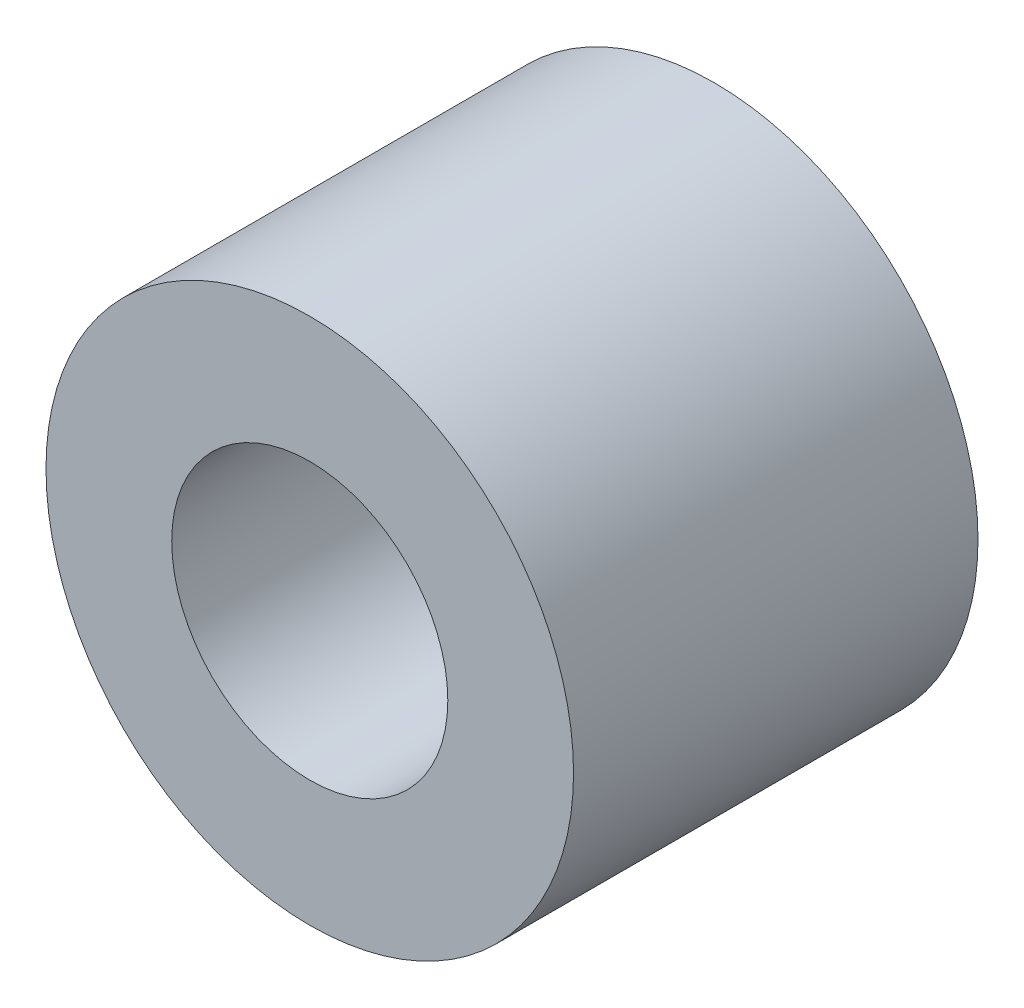
from build123d import *

# Parameters (mm, degrees)
CROQUIS1_R              = 15
SALIENTE_EXTRUIR1_DEPTH = 23
CROQUIS2_R              = 7.85
CORTAR_EXTRUIR1_DEPTH   = 16
CROQUIS3_R              = 1.5
CORTAR_EXTRUIR2_DEPTH   = 16


with BuildPart() as part:
    # Croquis1 → Saliente-Extruir1 (new body)
    with BuildSketch(Plane.XY):
        Circle(CROQUIS1_R)
    extrude(amount=-SALIENTE_EXTRUIR1_DEPTH)

    # Croquis2 → Cortar-Extruir1 (cut)
    with BuildSketch(Plane.XY):
        Circle(CROQUIS2_R)
    extrude(amount=-CORTAR_EXTRUIR1_DEPTH, mode=Mode.SUBTRACT)

    # Croquis3 → Cortar-Extruir2 (cut)
    with BuildSketch(Plane(origin=(0, 0, -23), x_dir=(-1, 0, 0), z_dir=(0, 0, -1))):
        Circle(CROQUIS3_R)
    extrude(amount=-CORTAR_EXTRUIR2_DEPTH, mode=Mode.SUBTRACT)


solid = part.part
